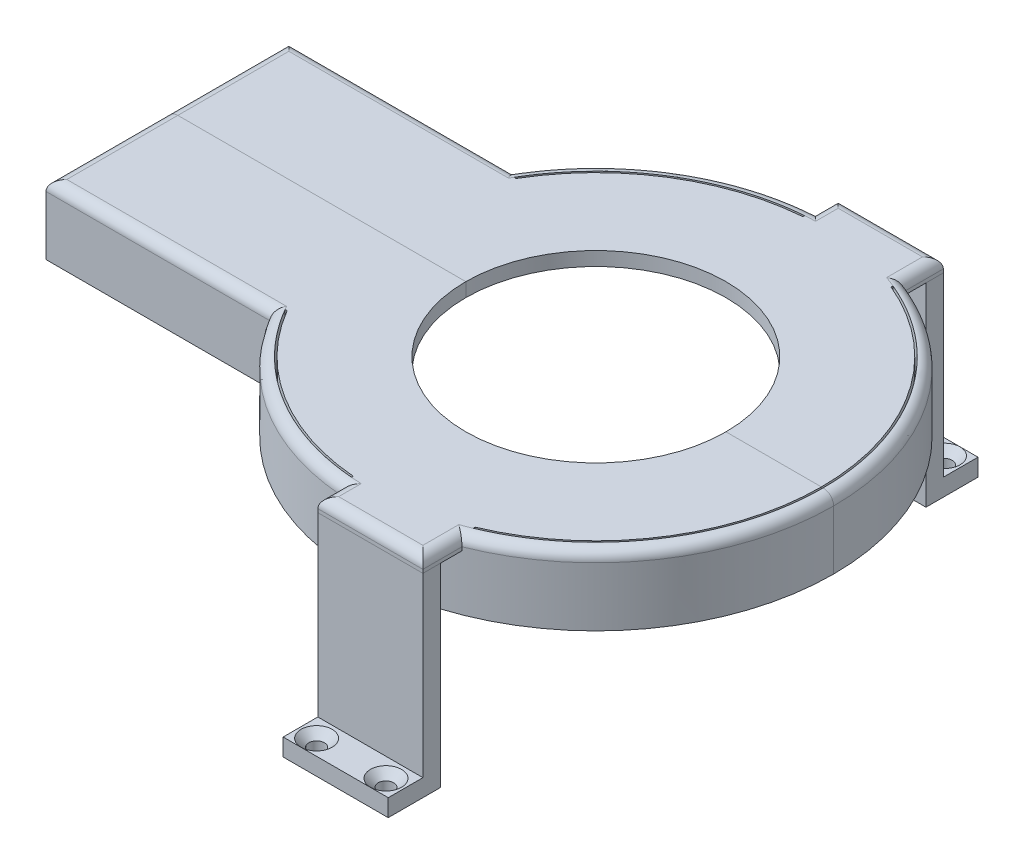
from build123d import *

# Parameters (mm, degrees)
SKETCH14_W                                   = 30.292501962
SKETCH14_H                                   = 5
BOSS_EXTRUDE3_DEPTH                          = 51
BOSS_EXTRUDE4_DEPTH                          = 4
SKETCH16_W                                   = 30.292501962
SKETCH16_H                                   = 15
BOSS_EXTRUDE5_DEPTH                          = 5
CSK_FOR_M4_HEX_SOCKET_COUNTERSUNK_HE_2_COUNT = 2
CSK_FOR_M4_HEX_SOCKET_COUNTERSUNK_HE_2_PITCH = 20
SKETCH19_W                                   = 30.292501962
SKETCH19_H                                   = 15.882703229
BOSS_EXTRUDE6_DEPTH                          = 4
BOSS_EXTRUDE7_DEPTH                          = 20
FILLET6_R                                    = 3


with BuildPart() as part:
    # Sketch14 → Boss-Extrude3 (new body)
    with BuildSketch(Plane(origin=(0, 0, 0), x_dir=(1, 0, 0), z_dir=(0, 1, 0))):
        with Locations((10, -72.5)):
            Rectangle(SKETCH14_W, SKETCH14_H)
    extrude(amount=-BOSS_EXTRUDE3_DEPTH)

    # Sketch16 → Boss-Extrude5 (add)
    with BuildSketch(Plane.XZ.offset(51)):
        with Locations((10, 77.5)):
            Rectangle(SKETCH16_W, SKETCH16_H)
    extrude(amount=BOSS_EXTRUDE5_DEPTH)

    # Sketch18 → CSK for M4 Hex Socket Countersunk Head1 (revolve, cut)
    with BuildSketch(Plane(origin=(20, -51, 80.5), x_dir=(0, 0, 1), z_dir=(1, 0, 0))):
        Polygon((0, 0), (0, 5), (2.25, 5), (2.25, 2.23), (4.48, 0), align=None)
    csk_for_m4_hex_socket_countersunk_head1 = revolve(axis=Axis((20, -44.65, 80.5), (0, -1, 0)), mode=Mode.SUBTRACT)

    # CSK for M4 Hex Socket Countersunk He 2: CSK for M4 Hex Socket Countersunk Head1 ×2
    with Locations(*[(-i * CSK_FOR_M4_HEX_SOCKET_COUNTERSUNK_HE_2_PITCH, 0, 0) for i in range(1, CSK_FOR_M4_HEX_SOCKET_COUNTERSUNK_HE_2_COUNT)]):
        add(csk_for_m4_hex_socket_countersunk_head1, mode=Mode.SUBTRACT)


with BuildPart() as body_2:
    # Sketch15 → Boss-Extrude4 (new body)
    with BuildSketch(Plane(origin=(0, 0, 0), x_dir=(1, 0, 0), z_dir=(0, 1, 0))):
        with BuildLine():
            Line((-37.5, 0), (-65, 0))
            Line((-65, 0), (-120.5, 0))
            Line((-120.5, 0), (-120.5, -33))
            Line((-120.5, -33), (-56, -33))
            ThreePointArc((-56, -33), (17.102631376, -62.70964838), (65, 0))
            Line((65, 0), (37.5, 0))
            ThreePointArc((37.5, 0), (0, -37.5), (-37.5, 0))
        make_face()
    extrude(amount=BOSS_EXTRUDE4_DEPTH)

    # Sketch19 → Boss-Extrude6 (add)
    with BuildSketch(Plane(origin=(0, 0, 0), x_dir=(1, 0, 0), z_dir=(0, 1, 0))):
        with Locations((10, -67.058648386)):
            Rectangle(SKETCH19_W, SKETCH19_H)
    extrude(amount=BOSS_EXTRUDE6_DEPTH)

    # Sketch20 → Boss-Extrude7 (add)
    with BuildSketch(Plane(origin=(0, 4, 0), x_dir=(1, 0, 0), z_dir=(0, 1, 0))):
        with BuildLine():
            Line((-120.5, 0), (-123.5, 0))
            Line((-123.5, 0), (-123.5, -34.9996821))
            Line((-123.5, -34.9996821), (-58.914338171, -34.9996821))
            ThreePointArc((-58.914338171, -34.9996821), (18.147801597, -66.079757009), (68.52646926, 0))
            Line((68.52646926, 0), (65.498091575, 0))
            ThreePointArc((65.498091575, 0), (17.092243004, -63.228595027), (-56.577380639, -33))
            Line((-56.577380639, -33), (-120.5, -33))
            Line((-120.5, -33), (-120.5, 0))
        make_face()
    extrude(amount=-BOSS_EXTRUDE7_DEPTH)

    # Fillet6
    fillet6_edges = [body_2.edges().sort_by_distance(p)[0] for p in [
        (56.652717428, 4, 38.553165852),
        (25.146250981, 4, 69.372962879),
        (10, 4, 75),
        (-5.146250981, 4, 71.666478784),
        (-36.107015717, 4, 58.242256182),
        (-123.5, 4, 17.49984105),
        (-91.207169085, 4, 34.9996821),
    ]]
    fillet(fillet6_edges, radius=FILLET6_R)


with BuildPart() as body_3:
    # Mirror35: mirrored copy
    add(part.part.mirror(Plane.XY))


with BuildPart() as body_4:
    # Mirror35 2: mirrored copy
    add(body_2.part.mirror(Plane.XY))


solid = Compound([part.part, body_2.part, body_3.part, body_4.part])
